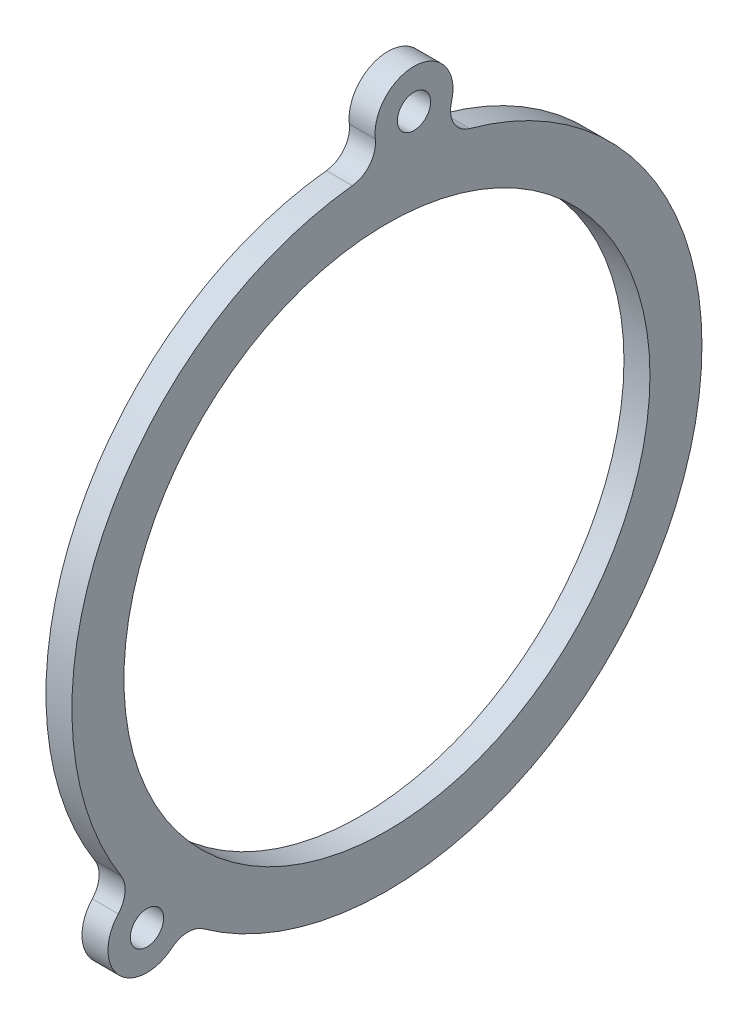
from build123d import *

# Parameters (mm, degrees)
SKETCH1_R           = 32.131
SKETCH1_R_2         = 2.032
BOSS_EXTRUDE1_DEPTH = 3.175
FILLET1_R           = 3.175


with BuildPart() as part:
    # Sketch1 → Boss-Extrude1 (new body)
    with BuildSketch(Plane(origin=(0, 0, 0), x_dir=(0, 0, -1), z_dir=(1, 0, 0))):
        with BuildLine():
            ThreePointArc((0.539277511, 38.477221063), (-34.317069018, 17.410517941), (-30.731600023, -23.159363571))
            ThreePointArc((-30.731600023, -23.159363571), (-32.777019562, -30.977797205), (-24.855674027, -29.376569399))
            ThreePointArc((-24.855674027, -29.376569399), (35.104868111, -15.761839864), (5.438477754, 38.094754504))
            ThreePointArc((5.438477754, 38.094754504), (3.677072288, 47.101407959), (0.539277511, 38.477221063))
        make_face()
        Circle(SKETCH1_R, mode=Mode.SUBTRACT)
        with Locations((3.306405321, 42.353354437)):
            Circle(SKETCH1_R_2, mode=Mode.SUBTRACT)
        with Locations((-29.315764749, -27.706540357)):
            Circle(SKETCH1_R_2, mode=Mode.SUBTRACT)
    extrude(amount=BOSS_EXTRUDE1_DEPTH)

    # Fillet1
    fillet1_edges = [part.edges().sort_by_distance(p)[0] for p in [
        (1.5875, -23.159363571, 30.731600023),
        (1.5875, 38.477221063, -0.539277511),
        (1.5875, 38.094754504, -5.438477754),
        (1.5875, -29.376569399, 24.855674027),
    ]]
    fillet(fillet1_edges, radius=FILLET1_R)


solid = part.part
